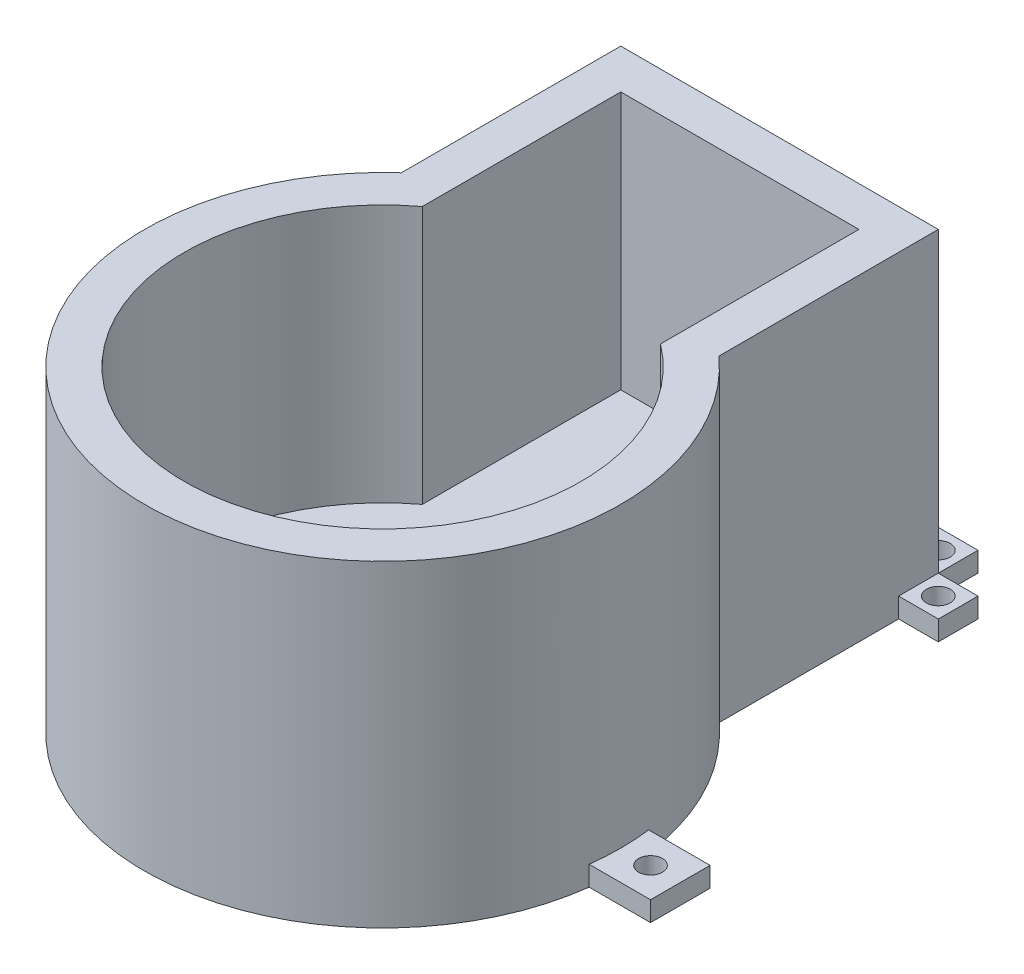
from build123d import *

# Parameters (mm, degrees)
BOSS_EXTRUDE1_DEPTH = 80
CUT_EXTRUDE1_DEPTH  = 65
SKETCH3_R           = 3
SKETCH3_W           = 10
SKETCH3_H           = 10
BOSS_EXTRUDE2_DEPTH = 5


with BuildPart() as part:
    # Sketch1 → Boss-Extrude1 (new body)
    with BuildSketch(Plane(origin=(0, 0, 0), x_dir=(1, 0, 0), z_dir=(0, 1, 0))):
        with BuildLine():
            Line((-40, -40), (-40, -15.27864045))
            ThreePointArc((-40, -15.27864045), (-24.494897428, -114.772255751), (60, -60))
            ThreePointArc((60, -60), (54.772255751, -35.505102572), (40, -15.27864045))
            Line((40, -15.27864045), (40, -40))
            Line((40, -40), (-40, -40))
        make_face()
        with BuildLine():
            ThreePointArc((40, -15.27864045), (0, 0), (-40, -15.27864045))
            Line((-40, -15.27864045), (-40, -40))
            Line((-40, -40), (40, -40))
            Line((40, -40), (40, -15.27864045))
        make_face()
        with BuildLine():
            Line((40, 40), (-40, 40))
            Line((-40, 40), (-40, -15.27864045))
            ThreePointArc((-40, -15.27864045), (0, 0), (40, -15.27864045))
            Line((40, -15.27864045), (40, 40))
        make_face()
    extrude(amount=BOSS_EXTRUDE1_DEPTH)

    # Sketch2 → Cut-Extrude1 (cut)
    with BuildSketch(Plane(origin=(0, 80, 0), x_dir=(1, 0, 0), z_dir=(0, 1, 0))):
        with BuildLine():
            Line((30, 30), (-30, 30))
            Line((-30, 30), (-30, -20))
            ThreePointArc((-30, -20), (0, -10), (30, -20))
            Line((30, -20), (30, 30))
        make_face()
        with BuildLine():
            ThreePointArc((30, -20), (0, -10), (-30, -20))
            Line((-30, -20), (-30, -30))
            Line((-30, -30), (30, -30))
            Line((30, -30), (30, -20))
        make_face()
        with BuildLine():
            Line((-30, -30), (-30, -20))
            ThreePointArc((-30, -20), (-22.360679775, -104.72135955), (50, -60))
            ThreePointArc((50, -60), (44.72135955, -37.639320225), (30, -20))
            Line((30, -20), (30, -30))
            Line((30, -30), (-30, -30))
        make_face()
    extrude(amount=-CUT_EXTRUDE1_DEPTH, mode=Mode.SUBTRACT)

    # Sketch3 → Boss-Extrude2 (add)
    # profile 1 of 6: a face of its own
    with BuildSketch(Plane.XZ):
        with BuildLine():
            Line((-75, 52.5), (-59.529404499, 52.5))
            ThreePointArc((-59.529404499, 52.5), (-60, 60), (-59.529404499, 67.5))
            Line((-59.529404499, 67.5), (-75, 67.5))
            Line((-75, 67.5), (-75, 52.5))
        make_face()
        with Locations(Location((-67.5, 60, 0), (0, 0, 270))):
            Circle(SKETCH3_R, mode=Mode.SUBTRACT)
    # profile 2 of 6: a face of its own
    with BuildSketch(Plane.XZ):
        with BuildLine():
            ThreePointArc((59.529404499, 67.5), (60, 60), (59.529404499, 52.5))
            Line((59.529404499, 52.5), (75, 52.5))
            Line((75, 52.5), (75, 67.5))
            Line((75, 67.5), (59.529404499, 67.5))
        make_face()
        with Locations(Location((67.5, 60, 0), (0, 0, 270))):
            Circle(SKETCH3_R, mode=Mode.SUBTRACT)
    # profile 3 of 6: a face of its own
    with BuildSketch(Plane.XZ):
        with Locations((-45, -35)):
            Rectangle(SKETCH3_W, SKETCH3_H)
        with Locations(Location((-45, -35, 0), (0, 0, 270))):
            Circle(SKETCH3_R, mode=Mode.SUBTRACT)
    # profile 4 of 6: a face of its own
    with BuildSketch(Plane.XZ):
        with Locations((-35, -45)):
            Rectangle(SKETCH3_W, SKETCH3_H)
        with Locations(Location((-35, -45, 0), (0, 0, 270))):
            Circle(SKETCH3_R, mode=Mode.SUBTRACT)
    # profile 5 of 6: a face of its own
    with BuildSketch(Plane.XZ):
        with Locations((35, -45)):
            Rectangle(SKETCH3_W, SKETCH3_H)
        with Locations(Location((35, -45, 0), (0, 0, 270))):
            Circle(SKETCH3_R, mode=Mode.SUBTRACT)
    # profile 6 of 6: a face of its own
    with BuildSketch(Plane.XZ):
        with Locations((45, -35)):
            Rectangle(SKETCH3_W, SKETCH3_H)
        with Locations(Location((45, -35, 0), (0, 0, 270))):
            Circle(SKETCH3_R, mode=Mode.SUBTRACT)
    extrude(amount=-BOSS_EXTRUDE2_DEPTH)


solid = part.part
